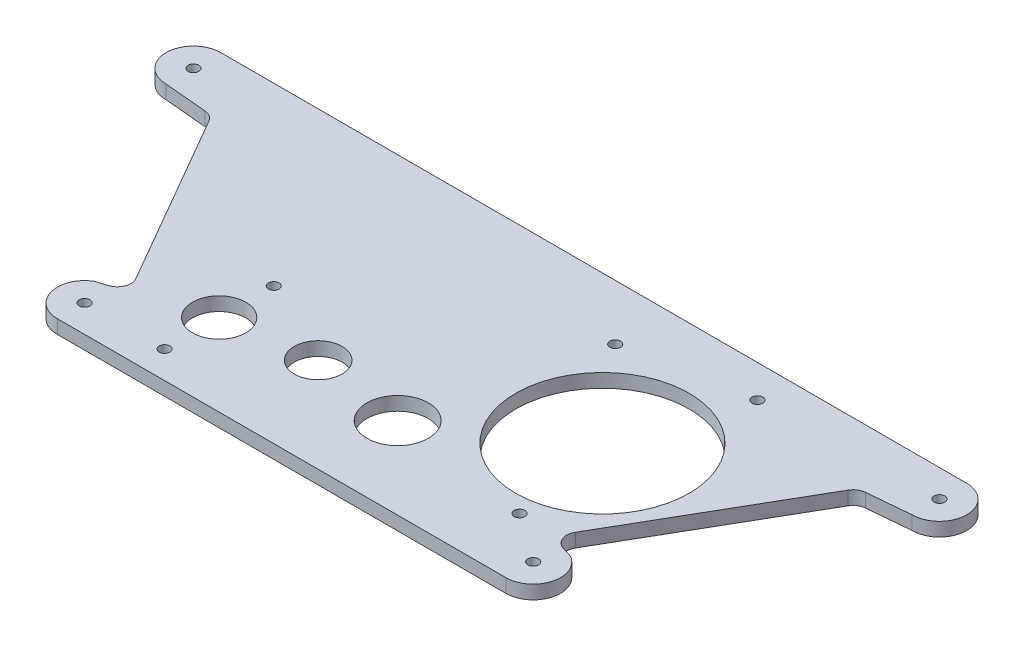
from build123d import *

# Parameters (mm, degrees)
SKETCH1_R           = 2.4892
SKETCH1_R_2         = 12.3825
SKETCH1_R_3         = 14.3002
SKETCH1_R_4         = 11.1252
SKETCH1_R_5         = 40.3225
BOSS_EXTRUDE1_DEPTH = 6.35
FILLET2_R           = 6.35


with BuildPart() as part:
    # Sketch1 → Boss-Extrude1 (new body)
    with BuildSketch(Plane(origin=(0, 0, 0), x_dir=(1, 0, 0), z_dir=(0, 1, 0))):
        with BuildLine():
            ThreePointArc((-173.478687828, 72.590962089), (-186.178687828, 59.890962089), (-173.478687828, 47.190962089))
            Line((-173.478687828, 47.190962089), (-150.271339409, 45.094655518))
            Line((-150.271339409, 45.094655518), (-98.200516404, -45.094655518))
            Line((-98.200516404, -45.094655518), (-110.67256166, -48.892439461))
            ThreePointArc((-110.67256166, -48.892439461), (-116.589819654, -63.177963961), (-104.32256166, -72.590962089))
            Line((-104.32256166, -72.590962089), (104.322561739, -72.590962089))
            ThreePointArc((104.322561739, -72.590962089), (116.589819664, -63.177963923), (110.67256166, -48.892439461))
            Line((110.67256166, -48.892439461), (98.200516404, -45.094655518))
            Line((98.200516404, -45.094655518), (150.271339409, 45.094655518))
            Line((150.271339409, 45.094655518), (173.478687828, 47.190962089))
            ThreePointArc((173.478687828, 47.190962089), (186.178687828, 59.890962094), (173.478687816, 72.590962089))
            Line((173.478687816, 72.590962089), (-173.478687828, 72.590962089))
        make_face()
        with Locations(Location((173.478687828, 59.890962089, 0), (0, 0, 270))):
            Circle(SKETCH1_R, mode=Mode.SUBTRACT)
        with Locations(Location((-104.32256166, -59.890962089, 0), (0, 0, 270))):
            Circle(SKETCH1_R, mode=Mode.SUBTRACT)
        with Locations(Location((-67.13289048, -59.890962089, 0), (0, 0, 270))):
            Circle(SKETCH1_R, mode=Mode.SUBTRACT)
        with Locations(Location((-67.13289048, -34.490962089, 0), (0, 0, 270))):
            Circle(SKETCH1_R_2, mode=Mode.SUBTRACT)
        with Locations(Location((-67.13289048, -9.090962089, 0), (0, 0, 270))):
            Circle(SKETCH1_R, mode=Mode.SUBTRACT)
        with Locations(Location((15.87430952, -34.490962089, 0), (0, 0, 270))):
            Circle(SKETCH1_R_3, mode=Mode.SUBTRACT)
        with Locations(Location((81.671791392, -43.565397329, 0), (0, 0, 270))):
            Circle(SKETCH1_R, mode=Mode.SUBTRACT)
        with Locations(Location((-26.911726221, -28.671379147, 0), (0, 0, 270))):
            Circle(SKETCH1_R_4, mode=Mode.SUBTRACT)
        with Locations(Location((-173.478687828, 59.890962089, 0), (0, 0, 270))):
            Circle(SKETCH1_R, mode=Mode.SUBTRACT)
        with Locations(Location((72.644027153, 3.985206637, 0), (0, 0, 270))):
            Circle(SKETCH1_R_5, mode=Mode.SUBTRACT)
        with Locations(Location((35.710881273, 46.848232392, 0), (0, 0, 270))):
            Circle(SKETCH1_R, mode=Mode.SUBTRACT)
        with Locations(Location((91.297923401, 57.401762089, 0), (0, 0, 270))):
            Circle(SKETCH1_R, mode=Mode.SUBTRACT)
        with Locations(Location((104.32256166, -59.890962089, 0), (0, 0, 270))):
            Circle(SKETCH1_R, mode=Mode.SUBTRACT)
    extrude(amount=BOSS_EXTRUDE1_DEPTH)

    # Fillet2
    fillet2_edges = [part.edges().sort_by_distance(p)[0] for p in [
        (150.271339409, 3.175, -45.094655518),
        (98.200516404, 3.175, 45.094655518),
        (-98.200516404, 3.175, 45.094655518),
        (-150.271339409, 3.175, -45.094655518),
    ]]
    fillet(fillet2_edges, radius=FILLET2_R)


solid = part.part
